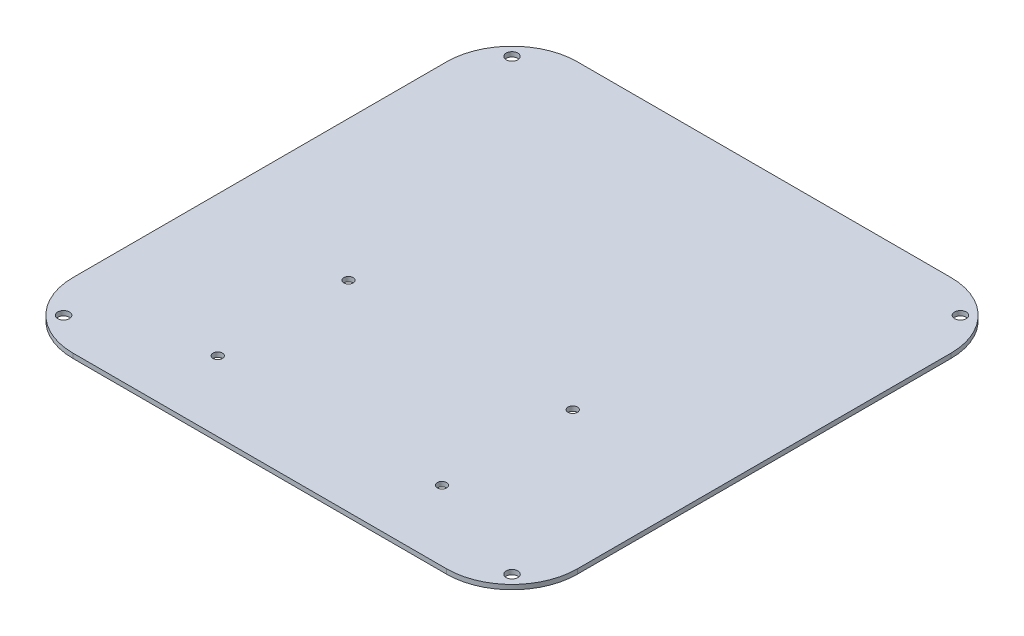
from build123d import *

# Parameters (mm, degrees)
SKETCH1_R           = 2
SKETCH1_R_2         = 2.5
BOSS_EXTRUDE1_DEPTH = 2


with BuildPart() as part:
    # Sketch1 → Boss-Extrude1 (new body)
    with BuildSketch(Plane(origin=(0, 0, 0), x_dir=(1, 0, 0), z_dir=(0, 1, 0))):
        with BuildLine():
            Line((-80, -108), (80, -108))
            ThreePointArc((80, -108), (99.798989873, -99.798989873), (108, -80))
            Line((108, -80), (108, 80))
            ThreePointArc((108, 80), (99.798989873, 99.798989873), (80, 108))
            Line((80, 108), (-80, 108))
            ThreePointArc((-80, 108), (-99.798989873, 99.798989873), (-108, 80))
            Line((-108, 80), (-108, -80))
            ThreePointArc((-108, -80), (-99.798989873, -99.798989873), (-80, -108))
        make_face()
        with Locations(Location((-48, -22, 0), (0, 0, 270))):
            Circle(SKETCH1_R, mode=Mode.SUBTRACT)
        with Locations(Location((-48, -78, 0), (0, 0, 270))):
            Circle(SKETCH1_R, mode=Mode.SUBTRACT)
        with Locations(Location((48, -78, 0), (0, 0, 270))):
            Circle(SKETCH1_R, mode=Mode.SUBTRACT)
        with Locations(Location((48, -22, 0), (0, 0, 270))):
            Circle(SKETCH1_R, mode=Mode.SUBTRACT)
        with Locations(Location((-96, 96, 0), (0, 0, 270))):
            Circle(SKETCH1_R_2, mode=Mode.SUBTRACT)
        with Locations(Location((96, 96, 0), (0, 0, 270))):
            Circle(SKETCH1_R_2, mode=Mode.SUBTRACT)
        with Locations(Location((96, -96, 0), (0, 0, 270))):
            Circle(SKETCH1_R_2, mode=Mode.SUBTRACT)
        with Locations(Location((-96, -96, 0), (0, 0, 270))):
            Circle(SKETCH1_R_2, mode=Mode.SUBTRACT)
    extrude(amount=BOSS_EXTRUDE1_DEPTH)


solid = part.part
